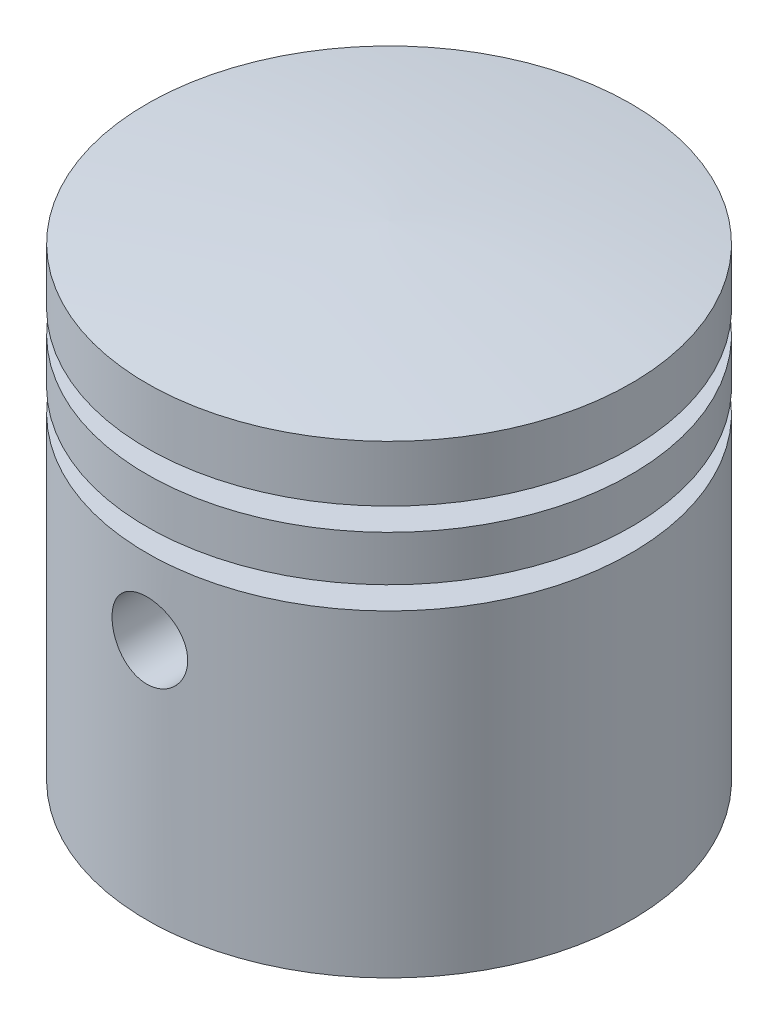
from build123d import *

# Parameters (mm, degrees)
SKETCH2_R               = 13
CUT_EXTRUDE1_DEPTH      = 10
SKETCH2_3_R             = 10
CUT_EXTRUDE2_DEPTH      = 24
CUT_EXTRUDE3_DEPTH      = 40.191836048
CUT_EXTRUDE3_DEPTH_BACK = 40.191836048
SKETCH3_R               = 2.5


with BuildPart() as part:
    # Sketch1 → Revolve1 (revolve)
    with BuildSketch(Plane(origin=(0, 0, 0), x_dir=(0, 0, -1), z_dir=(1, 0, 0))):
        with BuildLine():
            Line((-16, 30.707279543), (-16, 27))
            Line((-16, 27), (-12.51372549, 27))
            Line((-12.51372549, 27), (-12.51372549, 25.5))
            Line((-12.51372549, 25.5), (-16, 25.5))
            Line((-16, 25.5), (-16, 22.5))
            Line((-16, 22.5), (-12.51372549, 22.5))
            Line((-12.51372549, 22.5), (-12.51372549, 21))
            Line((-12.51372549, 21), (-16, 21))
            Line((-16, 21), (-16, 0))
            Line((-16, 0), (0, 0))
            Line((0, 0), (0, 32))
            ThreePointArc((0, 32), (-8.015966024, 31.551251231), (-16, 30.707279543))
        make_face()
    revolve(axis=Axis((0, 0, 0), (0, 1, 0)))

    # Sketch2 → Cut-Extrude1 (cut)
    with BuildSketch(Plane.XZ):
        Circle(SKETCH2_R)
    extrude(amount=-CUT_EXTRUDE1_DEPTH, mode=Mode.SUBTRACT)

    # Sketch2<3> → Cut-Extrude2 (cut)
    with BuildSketch(Plane.XZ):
        Circle(SKETCH2_3_R)
    extrude(amount=-CUT_EXTRUDE2_DEPTH, mode=Mode.SUBTRACT)

    # Sketch3 → Cut-Extrude3 (cut, two sides: drawn at the far end of the back side and taken through both)
    with BuildSketch(Plane.XY.offset(-CUT_EXTRUDE3_DEPTH_BACK)):
        with Locations((0, 16)):
            Circle(SKETCH3_R)
    extrude(amount=CUT_EXTRUDE3_DEPTH + CUT_EXTRUDE3_DEPTH_BACK, mode=Mode.SUBTRACT)


solid = part.part
